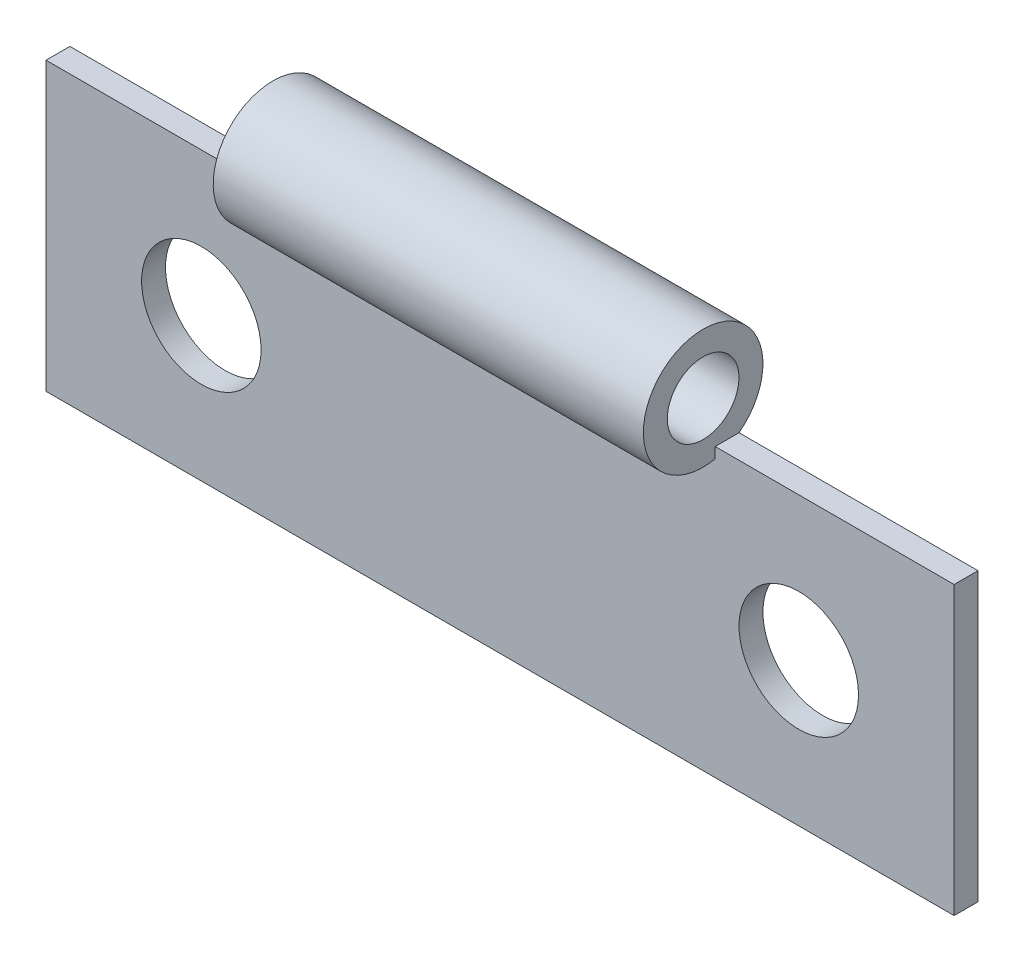
from build123d import *

# Parameters (mm, degrees)
SKETCH_1_W      = 38
SKETCH_1_H      = 12
SKETCH_1_R      = 2.5
EXTRUDE_1_DEPTH = 1
SKETCH_3_R      = 2.50184692
SKETCH_3_R_2    = 1.5
EXTRUDE_2_DEPTH = 18


with BuildPart() as part:
    # 草图1 → 凸台-拉伸1 (new body)
    with BuildSketch(Plane.XY):
        Rectangle(SKETCH_1_W, SKETCH_1_H)
        with Locations((12.5, 0)):
            Circle(SKETCH_1_R, mode=Mode.SUBTRACT)
        with Locations((-12.5, 0)):
            Circle(SKETCH_1_R, mode=Mode.SUBTRACT)
    extrude(amount=EXTRUDE_1_DEPTH)

    # 草图3 → 凸台-拉伸2 (add)
    with BuildSketch(Plane.ZY.offset(9)):
        with Locations((1.50184692, 8.00184692)):
            Circle(SKETCH_3_R)
        with Locations((1.50184692, 8.00184692)):
            Circle(SKETCH_3_R_2, mode=Mode.SUBTRACT)
    extrude(amount=-EXTRUDE_2_DEPTH)


solid = part.part
